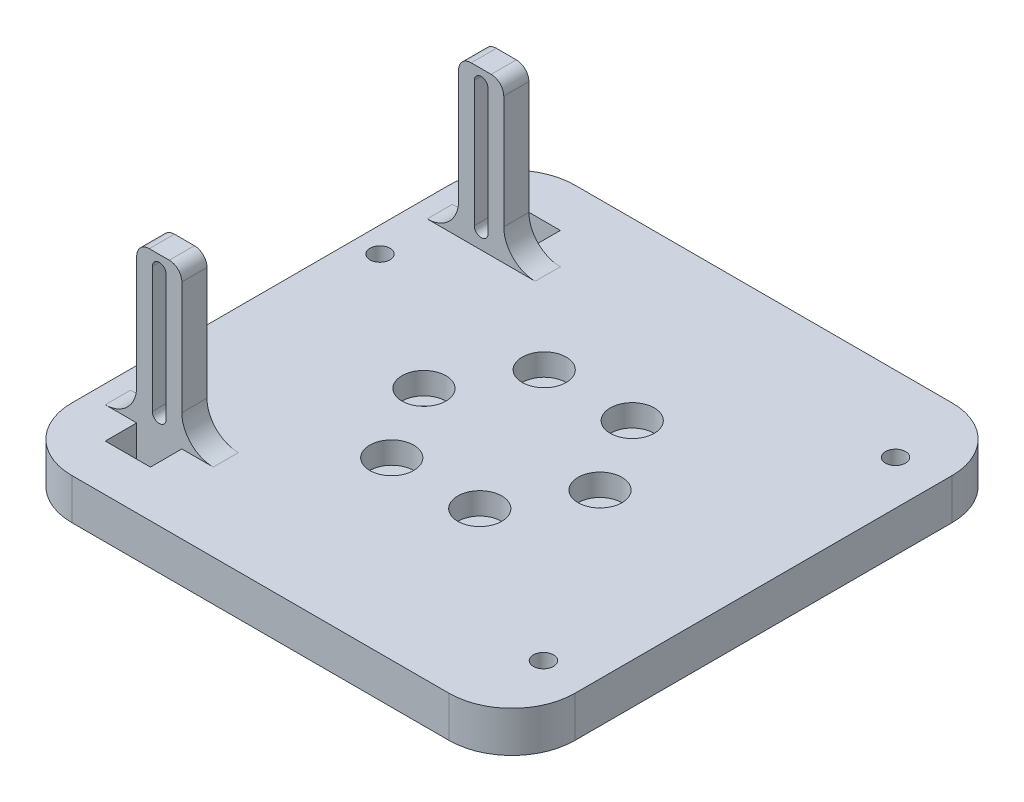
from build123d import *

# Parameters (mm, degrees)
SKETCH_1_W             = 80
SKETCH_1_H             = 80
EXTRUDE_1_DEPTH        = 6.5
FILLET_1_R             = 10
SKETCH_55_R            = 1.5
CUT_EXTRUDE_33_DEPTH   = 10
SKETCH_57_R            = 3.5
CUT_EXTRUDE_34_DEPTH   = 3.5
SKETCH_58_W            = 7.18
SKETCH_58_H            = 5
CUT_EXTRUDE_35_DEPTH   = 7.5
SKETCH_60_R            = 1.6
CUT_EXTRUDE_36_DEPTH   = 10
SKETCH_61_R            = 3.15
CUT_EXTRUDE_37_DEPTH   = 3
SKETCH_62_W            = 7.18
SKETCH_62_H            = 4
EXTRUDE_8_DEPTH        = 25
FILLET_8_R             = 5
CUT_EXTRUDE_38_DEPTH   = 25
FILLET_9_R             = 2
FILLET_8_OF_MIRROR_1_R = 5
FILLET_9_OF_MIRROR_1_R = 2


with BuildPart() as part:
    # 草图1 → 凸台-拉伸1 (new body)
    with BuildSketch(Plane(origin=(0, 0, 0), x_dir=(1, 0, 0), z_dir=(0, 1, 0))):
        Rectangle(SKETCH_1_W, SKETCH_1_H)
    extrude(amount=EXTRUDE_1_DEPTH)

    # 圆角1
    fillet_1_edges = [part.edges().sort_by_distance(p)[0] for p in [
        (40, 3.25, 40),
        (-40, 3.25, 40),
        (-40, 3.25, -40),
        (40, 3.25, -40),
    ]]
    fillet(fillet_1_edges, radius=FILLET_1_R)

    # 草图55 → 切除-拉伸33 (cut)
    with BuildSketch(Plane(origin=(0, 6.5, 0), x_dir=(1, 0, 0), z_dir=(0, 1, 0))):
        with Locations(Location((-7, -12.124355653, 0), (0, 0, 270))):
            Circle(SKETCH_55_R)
        with Locations(Location((-14, 0, 0), (0, 0, 270))):
            Circle(SKETCH_55_R)
        with Locations(Location((-7, 12.124355653, 0), (0, 0, 270))):
            Circle(SKETCH_55_R)
        with Locations(Location((7, 12.124355653, 0), (0, 0, 270))):
            Circle(SKETCH_55_R)
        with Locations(Location((7, -12.124355653, 0), (0, 0, 270))):
            Circle(SKETCH_55_R)
        with Locations(Location((14, 0, 0), (0, 0, 270))):
            Circle(SKETCH_55_R)
    extrude(amount=-CUT_EXTRUDE_33_DEPTH, mode=Mode.SUBTRACT)

    # 草图57 → 切除-拉伸34 (cut)
    with BuildSketch(Plane(origin=(0, 6.5, 0), x_dir=(1, 0, 0), z_dir=(0, 1, 0))):
        with Locations(Location((14, 0, 0), (0, 0, 270))):
            Circle(SKETCH_57_R)
        with Locations(Location((7, -12.124355653, 0), (0, 0, 270))):
            Circle(SKETCH_57_R)
        with Locations(Location((-7, -12.124355653, 0), (0, 0, 270))):
            Circle(SKETCH_57_R)
        with Locations(Location((-14, 0, 0), (0, 0, 270))):
            Circle(SKETCH_57_R)
        with Locations(Location((-7, 12.124355653, 0), (0, 0, 270))):
            Circle(SKETCH_57_R)
        with Locations(Location((7, 12.124355653, 0), (0, 0, 270))):
            Circle(SKETCH_57_R)
    extrude(amount=-CUT_EXTRUDE_34_DEPTH, mode=Mode.SUBTRACT)

    # 草图58 → 切除-拉伸35 (cut)
    with BuildSketch(Plane(origin=(0, 6.5, 0), x_dir=(1, 0, 0), z_dir=(0, 1, 0))):
        with Locations((-28.500986742, -30.1)):
            Rectangle(SKETCH_58_W, SKETCH_58_H)
        with Locations((-28.500986742, 30.1)):
            Rectangle(SKETCH_58_W, SKETCH_58_H)
    extrude(amount=-CUT_EXTRUDE_35_DEPTH, mode=Mode.SUBTRACT)

    # 草图60 → 切除-拉伸36 (cut)
    with BuildSketch(Plane(origin=(0, 6.5, 0), x_dir=(1, 0, 0), z_dir=(0, 1, 0))):
        with Locations(Location((-36, -15, 0), (0, 0, 270))):
            Circle(SKETCH_60_R)
        with Locations(Location((-36, 15, 0), (0, 0, 270))):
            Circle(SKETCH_60_R)
        with Locations(Location((33, -28, 0), (0, 0, 270))):
            Circle(SKETCH_60_R)
        with Locations(Location((33, 28, 0), (0, 0, 270))):
            Circle(SKETCH_60_R)
    extrude(amount=-CUT_EXTRUDE_36_DEPTH, mode=Mode.SUBTRACT)

    # 草图61 → 切除-拉伸37 (cut)
    with BuildSketch(Plane.XZ):
        with Locations(Location((-36, 15, 0), (0, 0, 270))):
            Circle(SKETCH_61_R)
        with Locations(Location((-36, -15, 0), (0, 0, 270))):
            Circle(SKETCH_61_R)
        with Locations(Location((33, -28, 0), (0, 0, 270))):
            Circle(SKETCH_61_R)
        with Locations(Location((33, 28, 0), (0, 0, 270))):
            Circle(SKETCH_61_R)
    extrude(amount=-CUT_EXTRUDE_37_DEPTH, mode=Mode.SUBTRACT)

    # 草图62 → 凸台-拉伸8 (add)
    with BuildSketch(Plane(origin=(0, 6.5, 0), x_dir=(1, 0, 0), z_dir=(0, 1, 0))):
        with Locations((-28.500986742, 25.6)):
            Rectangle(SKETCH_62_W, SKETCH_62_H)
    extrude_8 = extrude(amount=EXTRUDE_8_DEPTH)

    # 圆角8
    fillet_8_edges = [part.edges().sort_by_distance(p)[0] for p in [
        (-32.090986742, 6.5, -25.6),
        (-24.910986742, 6.5, -25.6),
    ]]
    fillet(fillet_8_edges, radius=FILLET_8_R)

    # 草图63 → 切除-拉伸38 (cut)
    with BuildSketch(Plane(origin=(0, 0, -27.6), x_dir=(-1, 0, 0), z_dir=(0, 0, -1))):
        with BuildLine():
            Line((29.600986742, 29.313400897), (29.600986742, 9.313400897))
            ThreePointArc((29.600986742, 9.313400897), (28.500986742, 8.213400897), (27.400986742, 9.313400897))
            Line((27.400986742, 9.313400897), (27.400986742, 29.313400897))
            ThreePointArc((27.400986742, 29.313400897), (28.500986742, 30.413400897), (29.600986742, 29.313400897))
        make_face()
    cut_extrude_38 = extrude(amount=-CUT_EXTRUDE_38_DEPTH, mode=Mode.SUBTRACT)

    # 圆角9
    fillet_9_edges = [part.edges().sort_by_distance(p)[0] for p in [
        (-32.090986742, 31.5, -25.6),
        (-24.910986742, 31.5, -25.6),
    ]]
    fillet(fillet_9_edges, radius=FILLET_9_R)

    # 镜向1: 凸台-拉伸8, 切除-拉伸38 across plane
    add(extrude_8.mirror(Plane.XY))
    add(cut_extrude_38.mirror(Plane.XY), mode=Mode.SUBTRACT)

    # 圆角8 of 镜向1
    fillet_8_of_mirror_1_edges = [part.edges().sort_by_distance(p)[0] for p in [
        (-32.090986742, 6.5, 25.6),
        (-24.910986742, 6.5, 25.6),
    ]]
    fillet(fillet_8_of_mirror_1_edges, radius=FILLET_8_OF_MIRROR_1_R)

    # 圆角9 of 镜向1
    fillet_9_of_mirror_1_edges = [part.edges().sort_by_distance(p)[0] for p in [
        (-32.090986742, 31.5, 25.6),
        (-24.910986742, 31.5, 25.6),
    ]]
    fillet(fillet_9_of_mirror_1_edges, radius=FILLET_9_OF_MIRROR_1_R)


solid = part.part
